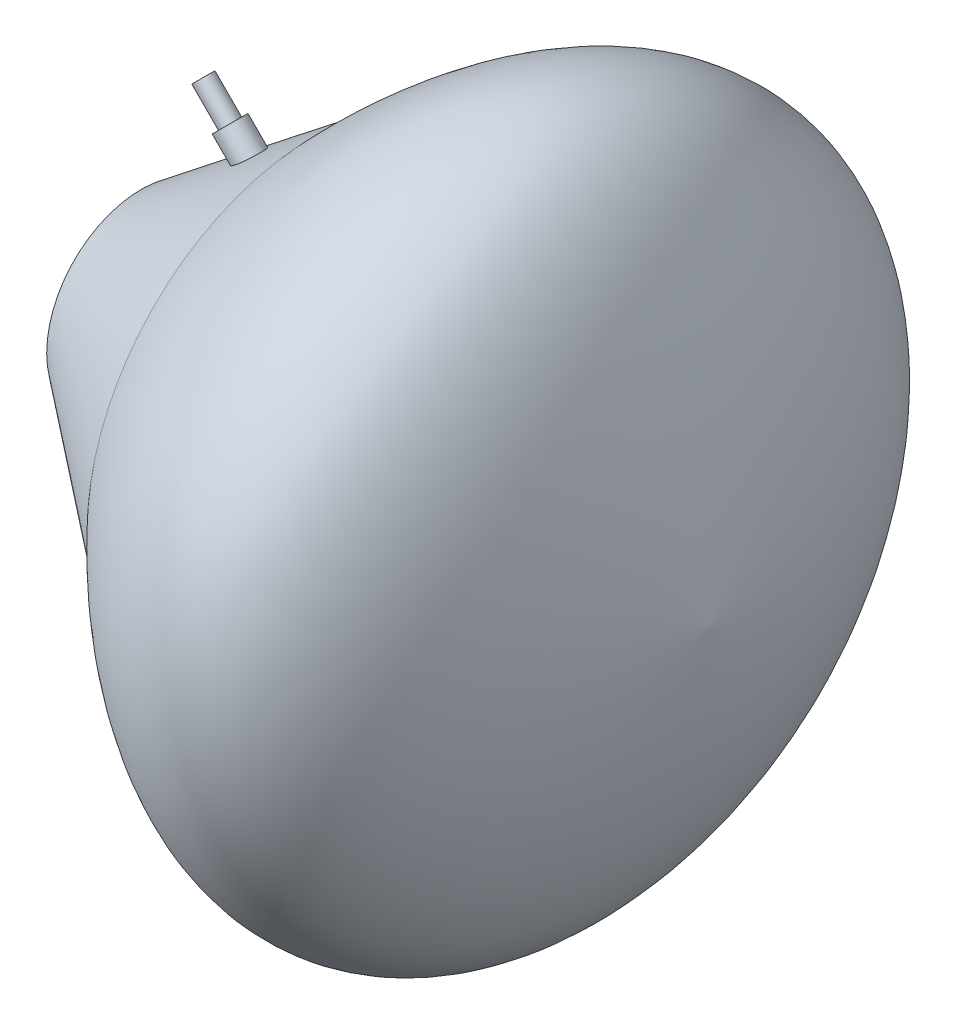
from build123d import *

# Parameters (mm, degrees)
CROQUIS3_R              = 2.5
SALIENTE_EXTRUIR1_DEPTH = 30
CROQUIS4_R              = 3.860951782
SALIENTE_EXTRUIR2_DEPTH = 20


with BuildPart() as part:
    # Croquis2 → Revolución1 (revolve)
    with BuildSketch(Plane.XY, mode=Mode.PRIVATE) as revoluci_n1_sk:
        with BuildLine():
            Line((0, 0), (0, 25))
            Line((0, 25), (46.059604384, 60.359357843))
            add(Edge.make_bspline(
                [(46.059604384, 60.359357843), (127.957826231, 146.665270252), (150.170471105, 0)],
                knots=[0, 0, 0, 1, 1, 1], degree=2))
            Line((150.170471105, 0), (0, 0))
        make_face()
    revolve(revoluci_n1_sk.sketch.rotate(Axis((0, 0, 0), (1, 0, 0)), 90), axis=Axis((0, 0, 0), (1, 0, 0)))

    # Croquis3 → Saliente-Extruir1 (add)
    with BuildSketch(Plane(origin=(0, 0, 0), x_dir=(0.7071067811865477, 0.7071067811865475, 0), z_dir=(-0.7071067811865475, 0.7071067811865477, 0))):
        with Locations(Location((53.218213551, 0, 0), (0, 0, 158.694408868))):
            Circle(CROQUIS3_R)
    extrude(amount=SALIENTE_EXTRUIR1_DEPTH)

    # Croquis4 → Saliente-Extruir2 (add)
    with BuildSketch(Plane(origin=(0, 0, 0), x_dir=(0.7071067811865477, 0.7071067811865475, 0), z_dir=(-0.7071067811865475, 0.7071067811865477, 0))):
        with Locations(Location((53.218213551, 0, 0), (0, 0, 159.621887119))):
            Circle(CROQUIS4_R)
    extrude(amount=SALIENTE_EXTRUIR2_DEPTH)


solid = part.part
